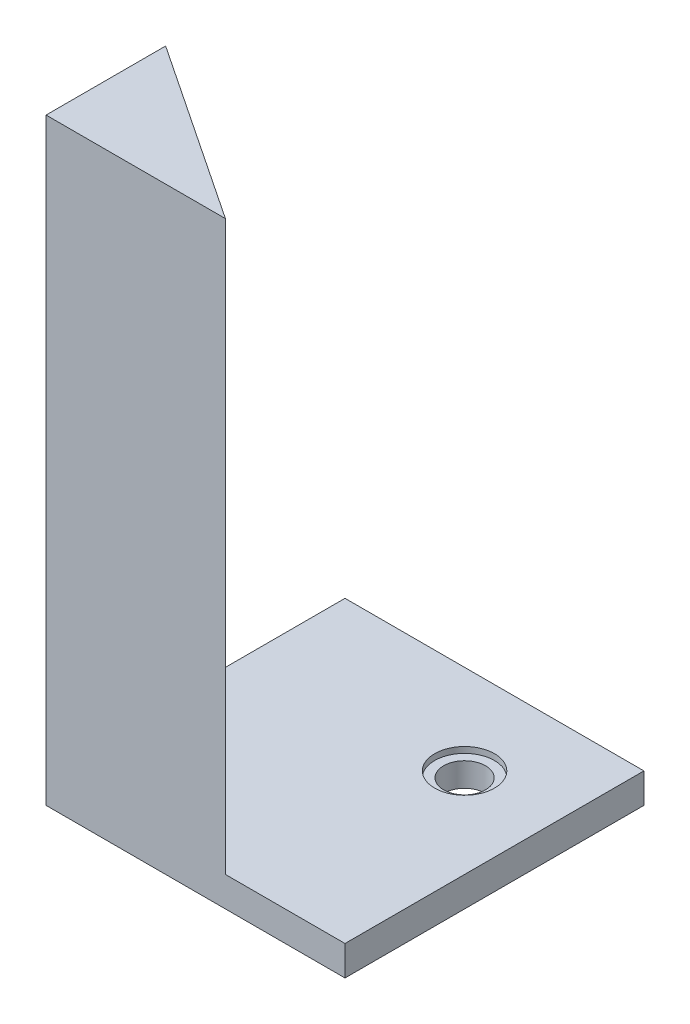
from build123d import *

# Parameters (mm, degrees)
BOSS_EXTRUDE1_DEPTH = 100
SKETCH2_W           = 50
SKETCH2_H           = 50
BOSS_EXTRUDE2_DEPTH = 5
SKETCH3_R           = 3.5
CUT_EXTRUDE1_DEPTH  = 119.427192823
SKETCH4_R           = 5
CUT_EXTRUDE2_DEPTH  = 1


with BuildPart() as part:
    # Sketch1 → Boss-Extrude1 (new body)
    with BuildSketch(Plane(origin=(0, 0, 0), x_dir=(1, 0, 0), z_dir=(0, 1, 0))):
        Polygon((0, 0), (0, 20), (30, 0), align=None)
    extrude(amount=BOSS_EXTRUDE1_DEPTH)

    # Sketch2 → Boss-Extrude2 (add)
    with BuildSketch(Plane.XZ):
        with Locations((25, -25)):
            Rectangle(SKETCH2_W, SKETCH2_H)
    extrude(amount=-BOSS_EXTRUDE2_DEPTH)

    # Sketch3 → Cut-Extrude1 (cut, through all)
    with BuildSketch(Plane(origin=(0, 5, 0), x_dir=(1, 0, 0), z_dir=(0, 1, 0))):
        with Locations(Location((35, 35, 0), (0, 0, 270))):
            Circle(SKETCH3_R)
    extrude(amount=-CUT_EXTRUDE1_DEPTH, mode=Mode.SUBTRACT)

    # Sketch4 → Cut-Extrude2 (cut)
    with BuildSketch(Plane(origin=(0, 5, 0), x_dir=(1, 0, 0), z_dir=(0, 1, 0))):
        with Locations(Location((35, 35, 0), (0, 0, 270))):
            Circle(SKETCH4_R)
    extrude(amount=-CUT_EXTRUDE2_DEPTH, mode=Mode.SUBTRACT)


solid = part.part
